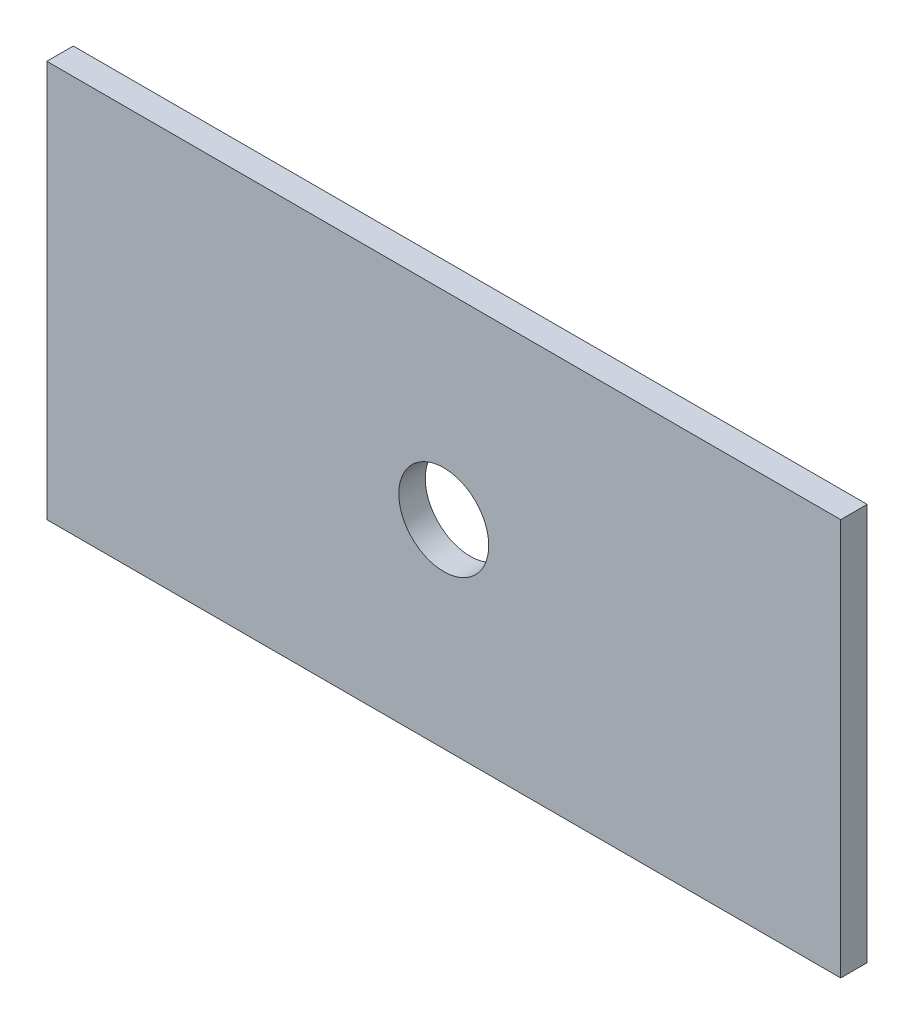
from build123d import *

# Parameters (mm, degrees)
SKETCH1_W            = 30
SKETCH1_H            = 15
BOSS_EXTRUDE1_DEPTH  = 1
M3_CLEARANCE_HOLE1_D = 3.4


with BuildPart() as part:
    # Sketch1 → Boss-Extrude1 (new body)
    with BuildSketch(Plane.XY):
        with Locations((15, 7.5)):
            Rectangle(SKETCH1_W, SKETCH1_H)
    extrude(amount=BOSS_EXTRUDE1_DEPTH)

    # M3 Clearance Hole1 (through all)
    with Locations(Plane(origin=(0, 0, 0), x_dir=(-1, 0, 0), z_dir=(0, 0, -1))):
        with Locations((-15, 7.5)):
            Hole(M3_CLEARANCE_HOLE1_D / 2)


solid = part.part
